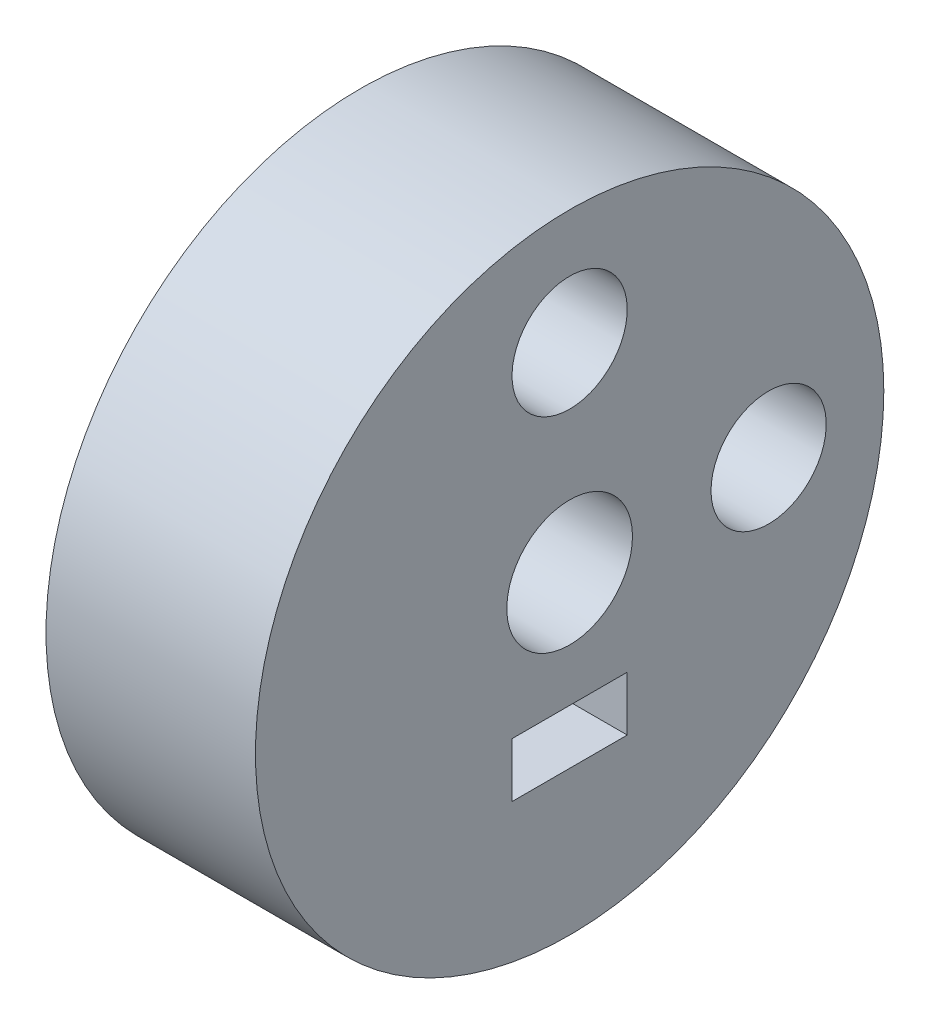
from build123d import *

# Parameters (mm, degrees)
CROQUIS2_R              = 15
CROQUIS2_R_2            = 3
SALIENTE_EXTRUIR1_DEPTH = 10
CROQUIS3_R              = 1.5
CORTAR_EXTRUIR1_DEPTH   = 24.452078799
CROQUIS6_W              = 5.5
CROQUIS6_H              = 2.6
CORTAR_EXTRUIR2_DEPTH   = 24.452078988
CORTAR_EXTRUIR3_START   = -11.5
CROQUIS7_R              = 2.75
CORTAR_EXTRUIR3_DEPTH   = 12.952078988
CROQUIS9_R              = 1.5
CORTAR_EXTRUIR4_DEPTH   = 24.45207897
CORTAR_EXTRUIR5_START   = -2
CROQUIS11_R             = 2.75
CORTAR_EXTRUIR5_DEPTH   = 22.45207897


with BuildPart() as part:
    # Croquis2 → Saliente-Extruir1 (new body)
    with BuildSketch(Plane(origin=(0, 0, 0), x_dir=(0, 0, -1), z_dir=(1, 0, 0))):
        Circle(CROQUIS2_R)
        Circle(CROQUIS2_R_2, mode=Mode.SUBTRACT)
    extrude(amount=-SALIENTE_EXTRUIR1_DEPTH)

    # Croquis3 → Cortar-Extruir1 (cut, through all)
    with BuildSketch(Plane(origin=(0, 0, 0), x_dir=(1, 0, 0), z_dir=(0, 1, 0))):
        with Locations((-5, 0)):
            Circle(CROQUIS3_R)
    extrude(amount=-CORTAR_EXTRUIR1_DEPTH, mode=Mode.SUBTRACT)

    # Croquis6 → Cortar-Extruir2 (cut, through all)
    with BuildSketch(Plane(origin=(0, 0, 0), x_dir=(0, 0, -1), z_dir=(1, 0, 0))):
        with Locations((0, -6.8)):
            Rectangle(CROQUIS6_W, CROQUIS6_H)
    extrude(amount=-CORTAR_EXTRUIR2_DEPTH, mode=Mode.SUBTRACT)

    # Croquis7 → Cortar-Extruir3 (cut, through all)
    with BuildSketch(Plane(origin=(0, 0, 0), x_dir=(1, 0, 0), z_dir=(0, 1, 0)).offset(CORTAR_EXTRUIR3_START)):
        with Locations((-5, 0)):
            Circle(CROQUIS7_R)
    extrude(amount=-CORTAR_EXTRUIR3_DEPTH, mode=Mode.SUBTRACT)

    # Croquis9 → Cortar-Extruir4 (cut, through all)
    with BuildSketch(Plane(origin=(0, 0, 0), x_dir=(0, 0, -1), z_dir=(1, 0, 0))):
        with Locations((9.5, 0)):
            Circle(CROQUIS9_R)
    cortar_extruir4 = extrude(amount=-CORTAR_EXTRUIR4_DEPTH, mode=Mode.SUBTRACT)

    # Croquis11 → Cortar-Extruir5 (cut, through all)
    with BuildSketch(Plane.ZY.offset(10).offset(CORTAR_EXTRUIR5_START)):
        with Locations((-9.5, 0)):
            Circle(CROQUIS11_R)
    cortar_extruir5 = extrude(amount=-CORTAR_EXTRUIR5_DEPTH, mode=Mode.SUBTRACT)

    # Simetría1: Cortar-Extruir4, Cortar-Extruir5 across plane
    add(cortar_extruir4.mirror(Plane(origin=(0, 0, 0), x_dir=(0, -0.7071067811865489, 0.7071067811865462), z_dir=(0, 0.7071067811865464, 0.7071067811865488))), mode=Mode.SUBTRACT)
    add(cortar_extruir5.mirror(Plane(origin=(0, 0, 0), x_dir=(0, -0.7071067811865489, 0.7071067811865462), z_dir=(0, 0.7071067811865464, 0.7071067811865488))), mode=Mode.SUBTRACT)


solid = part.part
